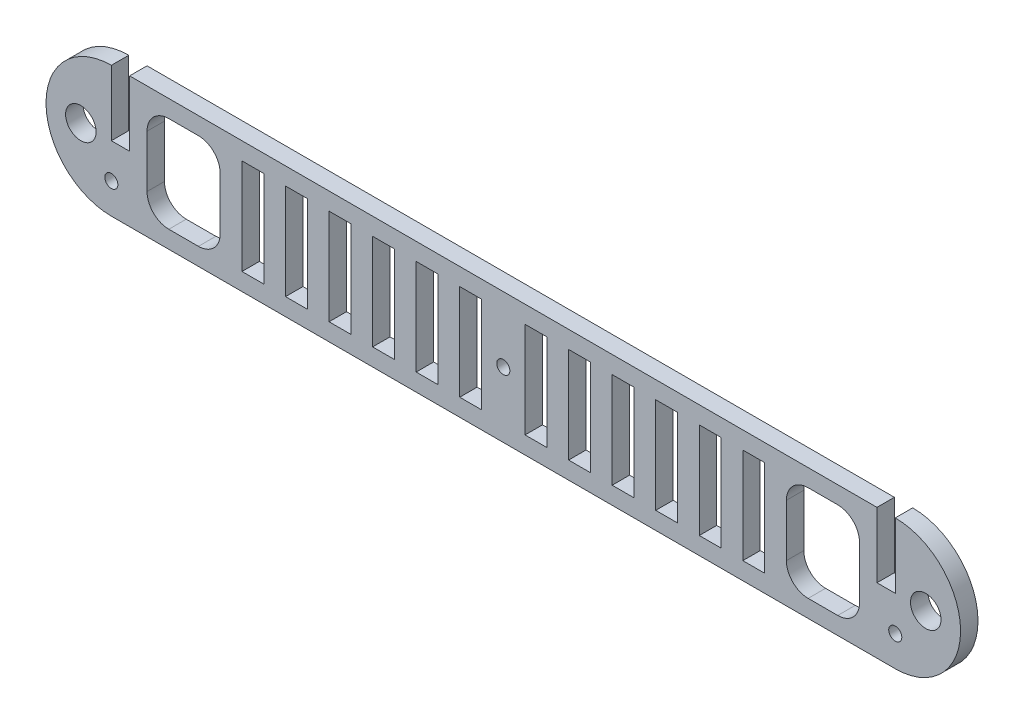
from build123d import *

# Parameters (mm, degrees)
EXTRUDE_1_DEPTH     = 2
SKETCH_11_W         = 4.2
SKETCH_11_H         = 15
SKETCH_11_W_2       = 16.8
SKETCH_11_H_2       = 22
SKETCH_11_W_3       = 5
SKETCH_11_R         = 3.5
SKETCH_11_R_2       = 1.5
CUT_EXTRUDE_1_DEPTH = 10
FILLET_1_R          = 5


with BuildPart() as part:
    # Эскиз1 → Бобышка-Вытянуть1 (new, symmetric)
    with BuildSketch(Plane.XY):
        with BuildLine():
            Line((-90, 15), (90, 15))
            ThreePointArc((90, 15), (105, 0), (90, -15))
            Line((90, -15), (-90, -15))
            ThreePointArc((-90, -15), (-105, 0), (-90, 15))
        make_face()
    extrude(amount=EXTRUDE_1_DEPTH, both=True)

    # Эскиз11 → Вырез-Вытянуть1 (cut)
    with BuildSketch(Plane(origin=(0, 0, -2), x_dir=(-1, 0, 0), z_dir=(0, 0, -1))):
        with Locations((-87.9, 7.5)):
            Rectangle(SKETCH_11_W, SKETCH_11_H)
        with Locations((-73.4, 0)):
            Rectangle(SKETCH_11_W_2, SKETCH_11_H_2)
        with Locations((-57.5, 0)):
            Rectangle(SKETCH_11_W_3, SKETCH_11_H_2)
        with Locations((-47.5, 0)):
            Rectangle(SKETCH_11_W_3, SKETCH_11_H_2)
        with Locations((-37.5, 0)):
            Rectangle(SKETCH_11_W_3, SKETCH_11_H_2)
        with Locations((-27.5, 0)):
            Rectangle(SKETCH_11_W_3, SKETCH_11_H_2)
        with Locations((-17.5, 0)):
            Rectangle(SKETCH_11_W_3, SKETCH_11_H_2)
        with Locations((-7.5, 0)):
            Rectangle(SKETCH_11_W_3, SKETCH_11_H_2)
        with Locations((7.5, 0)):
            Rectangle(SKETCH_11_W_3, SKETCH_11_H_2)
        with Locations((17.5, 0)):
            Rectangle(SKETCH_11_W_3, SKETCH_11_H_2)
        with Locations((27.5, 0)):
            Rectangle(SKETCH_11_W_3, SKETCH_11_H_2)
        with Locations((37.5, 0)):
            Rectangle(SKETCH_11_W_3, SKETCH_11_H_2)
        with Locations((47.5, 0)):
            Rectangle(SKETCH_11_W_3, SKETCH_11_H_2)
        with Locations((57.5, 0)):
            Rectangle(SKETCH_11_W_3, SKETCH_11_H_2)
        with Locations((73.4, 0)):
            Rectangle(SKETCH_11_W_2, SKETCH_11_H_2)
        with Locations((87.9, 7.5)):
            Rectangle(SKETCH_11_W, SKETCH_11_H)
        with Locations((97, 0)):
            Circle(SKETCH_11_R)
        with Locations((-97, 0)):
            Circle(SKETCH_11_R)
        Circle(SKETCH_11_R_2)
        with Locations((-90, -8)):
            Circle(SKETCH_11_R_2)
        with Locations((90, -8)):
            Circle(SKETCH_11_R_2)
    extrude(amount=-CUT_EXTRUDE_1_DEPTH, mode=Mode.SUBTRACT)

    # Скругление1
    fillet_1_edges = [part.edges().sort_by_distance(p)[0] for p in [
        (-65, 11, 0),
        (-81.8, 11, 0),
        (-81.8, -11, 0),
        (-65, -11, 0),
        (65, 11, 0),
        (65, -11, 0),
        (81.8, -11, 0),
        (81.8, 11, 0),
    ]]
    fillet(fillet_1_edges, radius=FILLET_1_R)


solid = part.part
